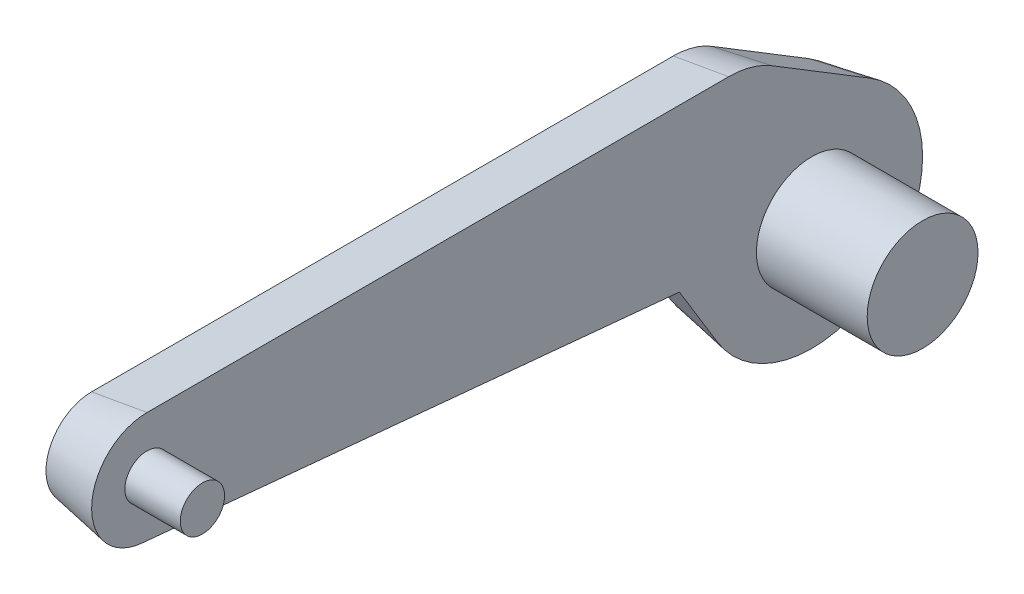
from build123d import *

# Parameters (mm, degrees)
SKETCH1_R           = 250
BOSS_EXTRUDE1_DEPTH = 250
BOSS_EXTRUDE4_DEPTH = 250
BOSS_EXTRUDE4_TAPER = 10
SKETCH5_R           = 100
BOSS_EXTRUDE6_DEPTH = 250


with BuildPart() as part:
    # Sketch1 → Boss-Extrude1 (new, symmetric)
    with BuildSketch(Plane(origin=(0, 0, 0), x_dir=(0, 0, -1), z_dir=(1, 0, 0))):
        Circle(SKETCH1_R)
    extrude(amount=BOSS_EXTRUDE1_DEPTH, both=True)

    # Sketch3 → Boss-Extrude4 (add)
    with BuildSketch(Plane.ZY.offset(250)):
        with BuildLine():
            ThreePointArc((-260.258802135, 426.925468801), (-353.553390593, -353.553390593), (426.925468801, -260.258802135))
            Line((426.925468801, -260.258802135), (597.489931153, 19.533129792))
            Line((597.489931153, 19.533129792), (3023.755656109, 251.131221719))
            ThreePointArc((3023.755656109, 251.131221719), (3249.717034431, 511.891287354), (3000, 750))
            Line((3000, 750), (375, 750))
            ThreePointArc((375, 750), (273.628870235, 736.038632351), (179.805898399, 695.194101601))
            Line((179.805898399, 695.194101601), (-260.258802135, 426.925468801))
        make_face()
    extrude(amount=BOSS_EXTRUDE4_DEPTH, taper=BOSS_EXTRUDE4_TAPER)

    # Sketch5 → Boss-Extrude6 (add)
    with BuildSketch(Plane(origin=(-250, 0, 0), x_dir=(0, 0, -1), z_dir=(1, 0, 0))):
        with Locations(Location((-3000, 500, 0), (0, 0, 180))):
            Circle(SKETCH5_R)
    extrude(amount=BOSS_EXTRUDE6_DEPTH)


solid = part.part
